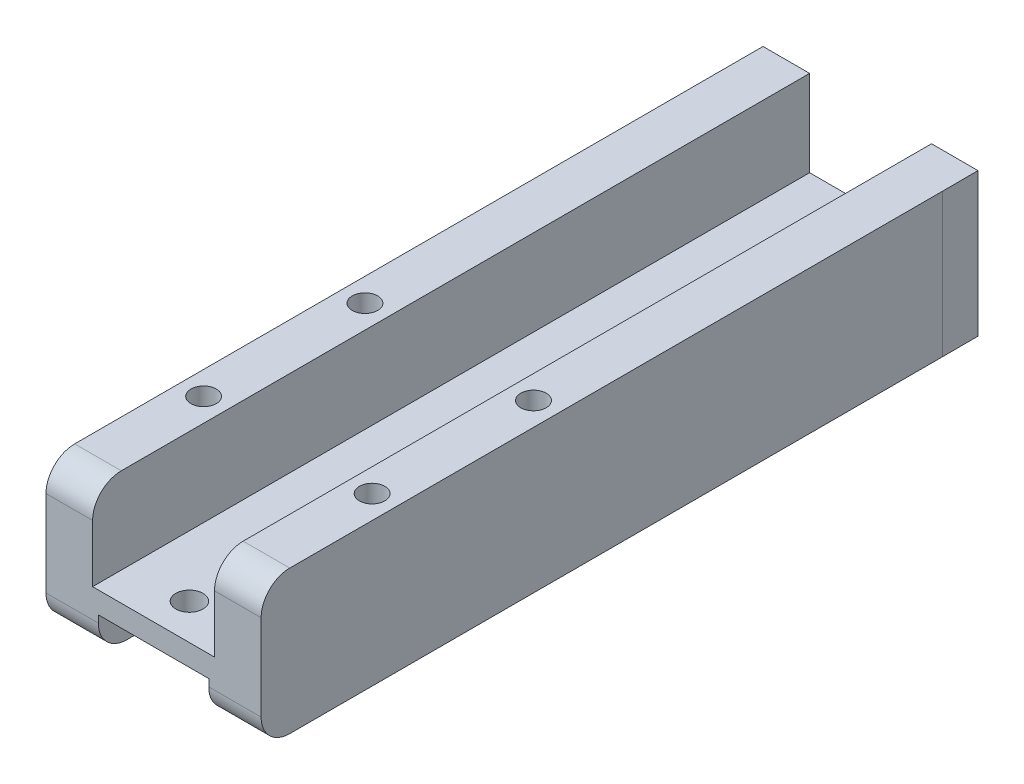
from build123d import *

# Parameters (mm, degrees)
BOSS_EXTRUDE1_DEPTH   = 38.1
SKETCH2_W             = 21.59
SKETCH2_H             = 254
CUT_EXTRUDE1_DEPTH    = 27.94
CUT_EXTRUDE8_DEPTH    = 86.725
SKETCH12_W            = 19.558
SKETCH12_H            = 12.7
CUT_EXTRUDE9_DEPTH    = 131.908603613
SKETCH13_R            = 2.413
CUT_EXTRUDE10_DEPTH   = 71.997998035
F_8_CLEARANCE_HOLE1_D = 4.4958
FILLET2_R             = 5.08


with BuildPart() as part:
    # Sketch1 → Boss-Extrude1 (new body)
    with BuildSketch(Plane(origin=(0, 0, 0), x_dir=(1, 0, 0), z_dir=(0, 1, 0))):
        Polygon((-19.05, 60.325), (-19.05, 66.675), (19.029461499, 66.675), (19.05, 60.325), (19.05, -60.325), (-19.05, -60.325), align=None)
    extrude(amount=BOSS_EXTRUDE1_DEPTH)

    # Sketch2 → Cut-Extrude1 (cut)
    with BuildSketch(Plane(origin=(0, 38.1, 0), x_dir=(1, 0, 0), z_dir=(0, 1, 0))):
        with Locations((0, -31.75)):
            Rectangle(SKETCH2_W, SKETCH2_H)
    extrude(amount=-CUT_EXTRUDE1_DEPTH, mode=Mode.SUBTRACT)

    # Sketch11 → Cut-Extrude8 (cut, through all)
    with BuildSketch(Plane.ZY.offset(19.05)):
        Polygon((60.325, 25.4), (35.000755529, 25.4), (21.802528375, 25.4), (-28.499244471, 25.4), (-41.697471625, 25.4), (-60.498358048, 25.4), (-66.675, 25.4), (-71.377274135, 25.4), (-71.377274135, 38.1), (-66.675, 38.1), (-60.498358048, 38.1), (60.325, 38.1), align=None)
    extrude(amount=-CUT_EXTRUDE8_DEPTH, mode=Mode.SUBTRACT)

    # Sketch12 → Cut-Extrude9 (cut, through all)
    with BuildSketch(Plane.XY.offset(60.325)):
        Rectangle(SKETCH12_W, SKETCH12_H)
    extrude(amount=-CUT_EXTRUDE9_DEPTH, mode=Mode.SUBTRACT)

    # Sketch13 → Cut-Extrude10 (cut, through all)
    with BuildSketch(Plane(origin=(0, 10.16, 0), x_dir=(1, 0, 0), z_dir=(0, 1, 0))):
        with Locations(Location((0, -53.975, 0), (0, 0, 270))):
            Circle(SKETCH13_R)
        with Locations(Location((0, 47.625, 0), (0, 0, 270))):
            Circle(SKETCH13_R)
        with Locations(Location((0, -3.175, 0), (0, 0, 270))):
            Circle(SKETCH13_R)
    extrude(amount=-CUT_EXTRUDE10_DEPTH, mode=Mode.SUBTRACT)

    # #8 Clearance Hole1 (through all)
    with Locations(Plane(origin=(0, 25.4, 0), x_dir=(1, 0, 0), z_dir=(0, 1, 0))):
        with Locations((-14.9225, -36.530628157), (-14.9225, -7.955628157), (14.9225, -7.955628157), (14.9225, -36.530628157)):
            Hole(F_8_CLEARANCE_HOLE1_D / 2)

    # Fillet2
    fillet2_edges = [part.edges().sort_by_distance(p)[0] for p in [
        (14.4145, 0, 60.325),
        (14.9225, 25.4, 60.325),
        (-14.9225, 25.4, 60.325),
        (-14.4145, 0, 60.325),
    ]]
    fillet(fillet2_edges, radius=FILLET2_R)


solid = part.part
